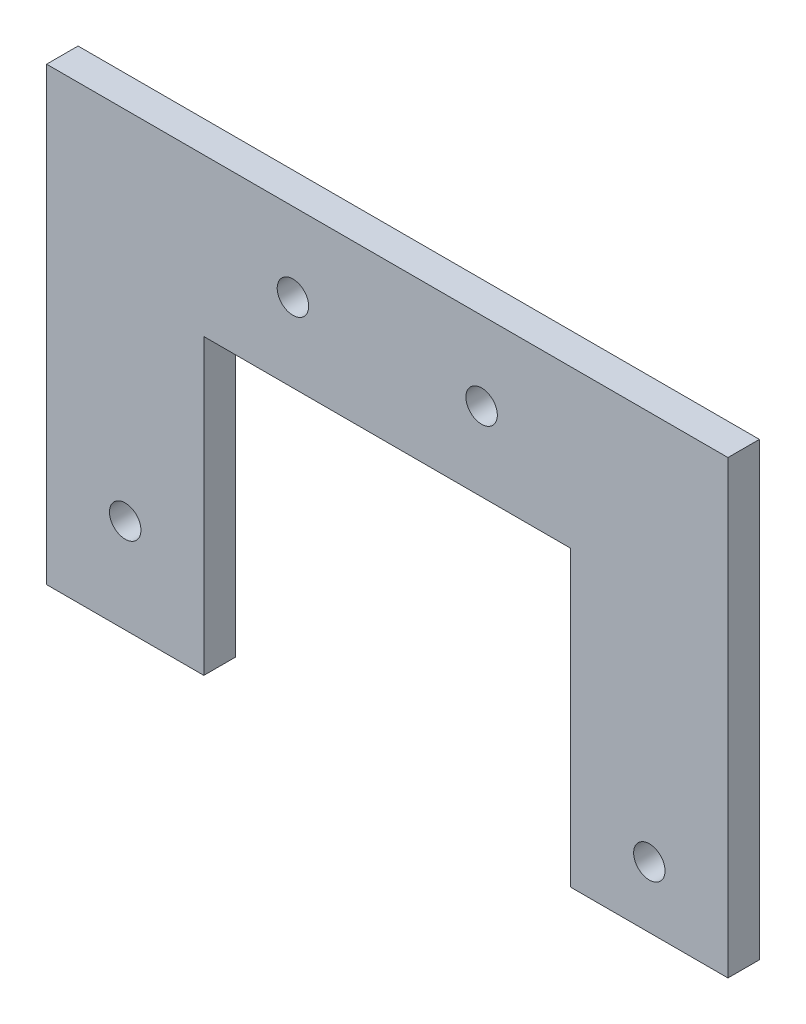
from build123d import *

# Parameters (mm, degrees)
EXTRUDE_1_DEPTH     = 3
SKETCH_2_R          = 1.5
CUT_EXTRUDE_1_DEPTH = 3


with BuildPart() as part:
    # 草图1 → 凸台-拉伸1 (new body)
    with BuildSketch(Plane.XY):
        Polygon((0, 0), (65, 0), (65, -43), (50, -43), (50, -15), (15, -15), (15, -43), (0, -43), align=None)
    extrude(amount=EXTRUDE_1_DEPTH)

    # 草图2 → 切除-拉伸1 (cut)
    with BuildSketch(Plane.XY.offset(3)):
        with Locations((57.5, -37.157951196)):
            Circle(SKETCH_2_R)
        with Locations((7.5, -34)):
            Circle(SKETCH_2_R)
        with Locations((23.5, -7.5)):
            Circle(SKETCH_2_R)
        with Locations((41.5, -7.5)):
            Circle(SKETCH_2_R)
    extrude(amount=-CUT_EXTRUDE_1_DEPTH, mode=Mode.SUBTRACT)


solid = part.part
